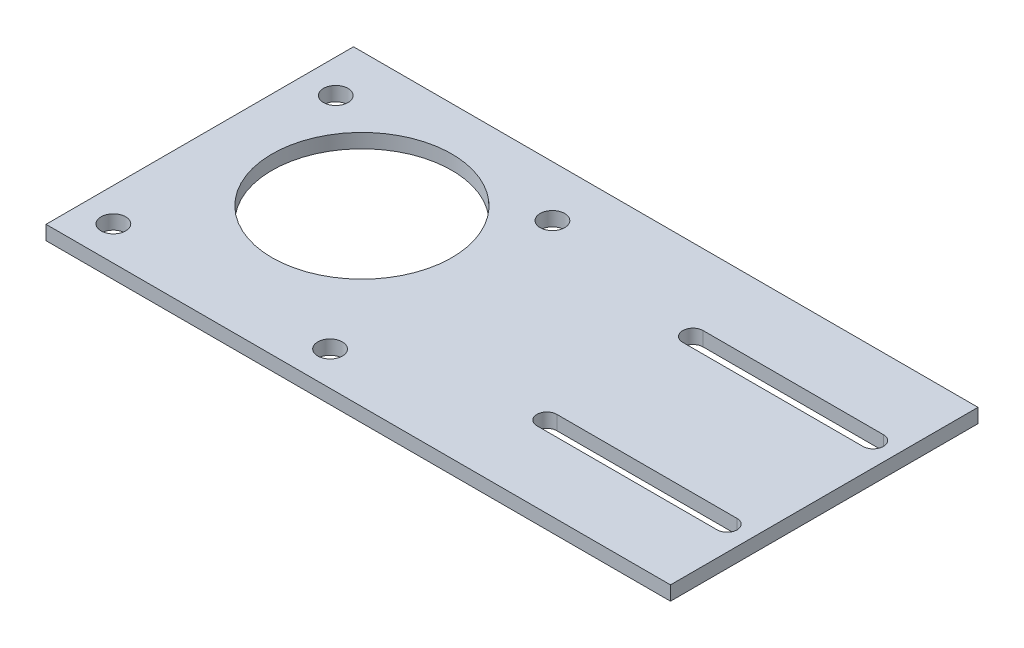
from build123d import *

# Parameters (mm, degrees)
SKETCH1_W           = 132
SKETCH1_H           = 65
BOSS_EXTRUDE1_DEPTH = 3
SKETCH2_R           = 19
SKETCH2_R_2         = 2.6
CUT_EXTRUDE3_DEPTH  = 3
CUT_EXTRUDE5_DEPTH  = 3


with BuildPart() as part:
    # Sketch1 → Boss-Extrude1 (new body)
    with BuildSketch(Plane(origin=(0, 0, 0), x_dir=(1, 0, 0), z_dir=(0, 1, 0))):
        with Locations((27.886363636, -7.829545455)):
            Rectangle(SKETCH1_W, SKETCH1_H)
    extrude(amount=BOSS_EXTRUDE1_DEPTH)

    # Sketch2 → Cut-Extrude3 (cut)
    with BuildSketch(Plane(origin=(0, 3, 0), x_dir=(1, 0, 0), z_dir=(0, 1, 0))):
        with Locations(Location((-8.113636364, -3.555015025, 0), (0, 0, 270))):
            Circle(SKETCH2_R)
        with Locations(Location((-31.076450467, 13.876917129, 0), (0, 0, 270))):
            Circle(SKETCH2_R_2)
        with Locations(Location((-31.076450467, -33.123082871, 0), (0, 0, 270))):
            Circle(SKETCH2_R_2)
        with Locations(Location((14.725739937, 13.876917129, 0), (0, 0, 270))):
            Circle(SKETCH2_R_2)
        with Locations(Location((14.725739937, -33.123082871, 0), (0, 0, 270))):
            Circle(SKETCH2_R_2)
    extrude(amount=-CUT_EXTRUDE3_DEPTH, mode=Mode.SUBTRACT)

    # Sketch5 → Cut-Extrude5 (cut)
    with BuildSketch(Plane(origin=(0, 3, 0), x_dir=(1, 0, 0), z_dir=(0, 1, 0))):
        with BuildLine():
            Line((50.793786384, 9.670454545), (88.893786384, 9.670454545))
            ThreePointArc((88.893786384, 9.670454545), (91.052786384, 7.511454545), (88.893786384, 5.352454545))
            Line((88.893786384, 5.352454545), (50.793786384, 5.352454545))
            ThreePointArc((50.793786384, 5.352454545), (48.634786384, 7.511454545), (50.793786384, 9.670454545))
        make_face()
        with BuildLine():
            Line((50.658524024, -21.129545455), (88.758524024, -21.129545455))
            ThreePointArc((88.758524024, -21.129545455), (90.858524024, -23.229545455), (88.758524024, -25.329545455))
            Line((88.758524024, -25.329545455), (50.658524024, -25.329545455))
            ThreePointArc((50.658524024, -25.329545455), (48.558524024, -23.229545455), (50.658524024, -21.129545455))
        make_face()
    extrude(amount=-CUT_EXTRUDE5_DEPTH, mode=Mode.SUBTRACT)


solid = part.part
